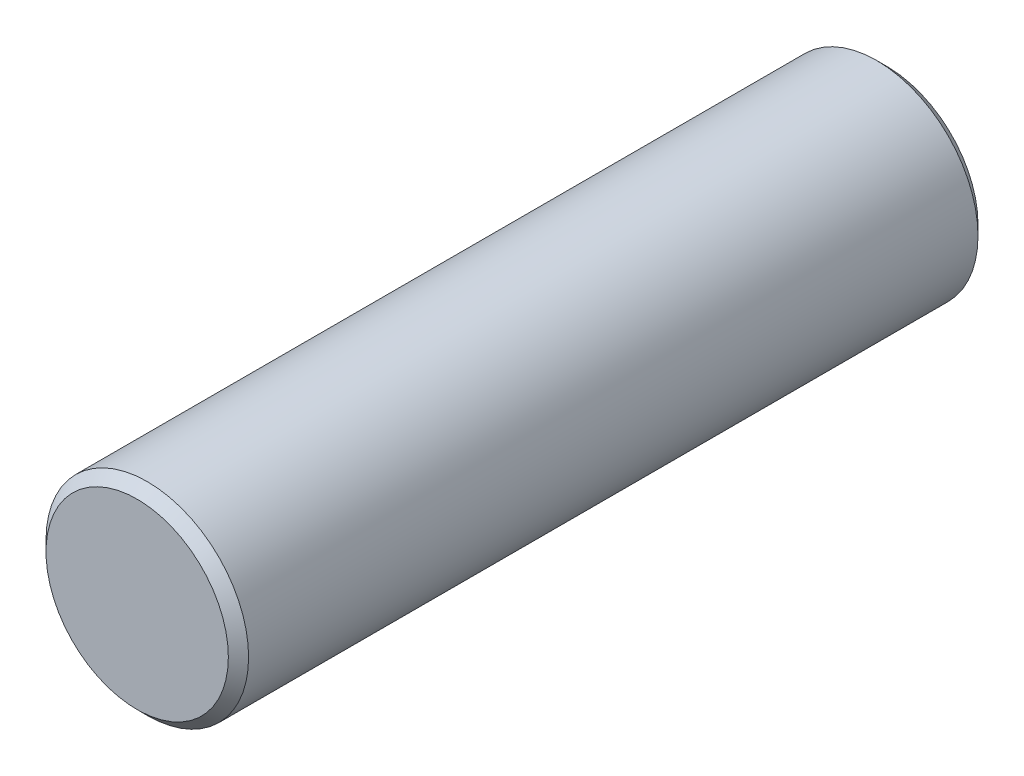
from build123d import *

# Parameters (mm, degrees)
SKETCH1_R           = 254
BOSS_EXTRUDE1_DEPTH = 1879.6
CHAMFER1_SIZE       = 25.4


with BuildPart() as part:
    # Sketch1 → Boss-Extrude1 (new body)
    with BuildSketch(Plane.XY):
        Circle(SKETCH1_R)
    extrude(amount=BOSS_EXTRUDE1_DEPTH)

    # Chamfer1
    chamfer1_edges = [part.edges().sort_by_distance(p)[0] for p in [
        (-254, 0, 0),
        (-254, 0, 1879.6),
    ]]
    chamfer(chamfer1_edges, length=CHAMFER1_SIZE)


solid = part.part
